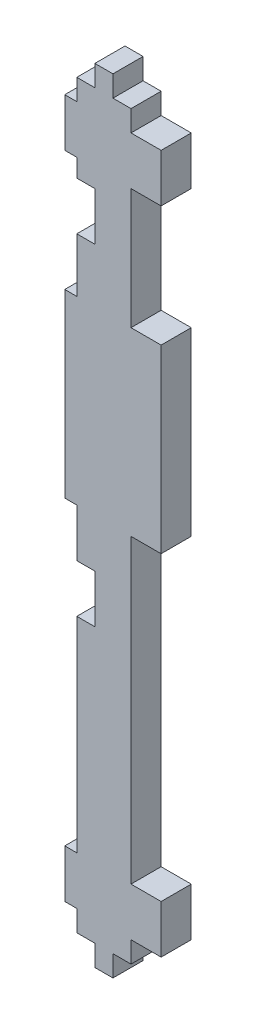
from build123d import *

# Parameters (mm, degrees)
BOSS_EXTRUDE1_DEPTH = 5


with BuildPart() as part:
    # Sketch1 → Boss-Extrude1 (new body)
    with BuildSketch(Plane.XY):
        Polygon((18.6, 77.474649456), (18.6, 73.974649456), (21.6, 73.974649456), (21.6, 70.474649456), (24.6, 70.474649456), (24.6, 73.974649456), (27.6, 73.974649456), (27.6, 77.474649456), (32.6, 77.474649456), (32.6, 85.474649456), (27.6, 85.474649456), (27.6, 135.474649456), (32.6, 135.474649456), (32.6, 165.474649456), (27.6, 165.474649456), (27.6, 185.474649456), (32.6, 185.474649456), (32.6, 193.474649456), (27.6, 193.474649456), (27.6, 196.974649456), (24.6, 196.974649456), (24.6, 200.474649456), (21.6, 200.474649456), (21.6, 196.974649456), (18.6, 196.974649456), (18.6, 193.474649456), (16.6, 193.474649456), (16.6, 185.474649456), (18.6, 185.474649456), (18.6, 182.474649456), (21.6, 182.474649456), (21.6, 174.474649456), (18.6, 174.474649456), (18.6, 165.474649456), (16.6, 165.474649456), (16.6, 135.474649456), (18.6, 135.474649456), (18.6, 127.474649456), (21.6, 127.474649456), (21.6, 119.474649456), (18.6, 119.474649456), (18.6, 85.474649456), (16.6, 85.474649456), (16.6, 77.474649456), align=None)
    extrude(amount=BOSS_EXTRUDE1_DEPTH)


solid = part.part
